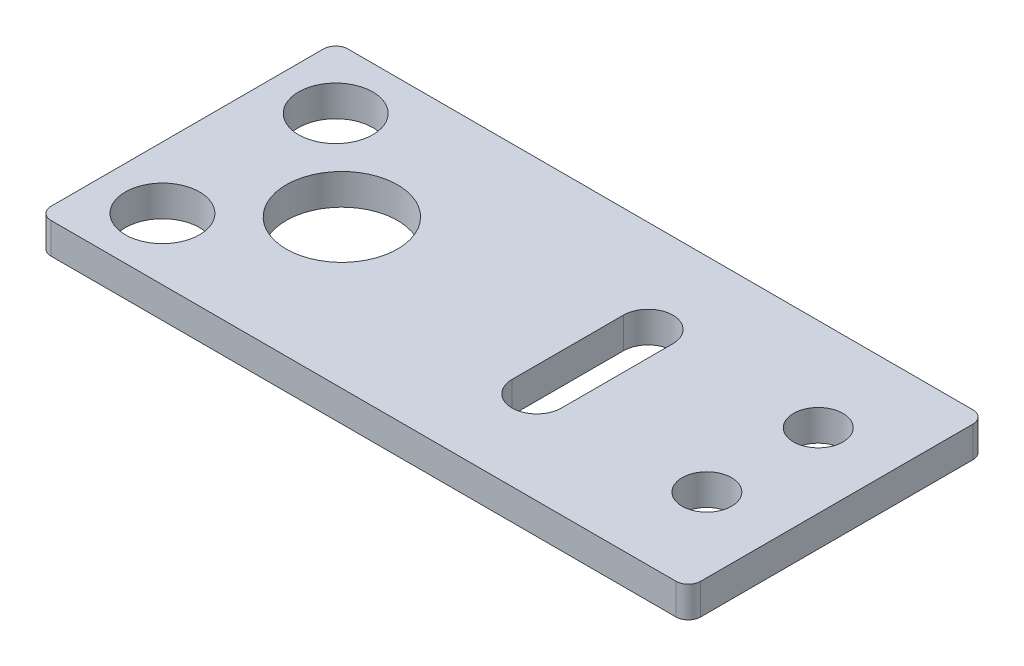
from build123d import *

# Parameters (mm, degrees)
SKETCH1_W           = 105
SKETCH1_H           = 48
SKETCH1_R           = 6
SKETCH1_R_2         = 9
SKETCH1_R_3         = 4
BOSS_EXTRUDE1_DEPTH = 5
FILLET1_R           = 2


with BuildPart() as part:
    # Sketch1 → Boss-Extrude1 (new body)
    with BuildSketch(Plane(origin=(0, 0, 0), x_dir=(1, 0, 0), z_dir=(0, 1, 0))):
        with Locations((52.5, 24)):
            Rectangle(SKETCH1_W, SKETCH1_H)
        with Locations(Location((10, 10, 0), (0, 0, 270))):
            Circle(SKETCH1_R, mode=Mode.SUBTRACT)
        with Locations(Location((10, 38, 0), (0, 0, 270))):
            Circle(SKETCH1_R, mode=Mode.SUBTRACT)
        with Locations(Location((25, 24, 0), (0, 0, 270))):
            Circle(SKETCH1_R_2, mode=Mode.SUBTRACT)
        with Locations(Location((93, 15, 0), (0, 0, 270))):
            Circle(SKETCH1_R_3, mode=Mode.SUBTRACT)
        with Locations(Location((93, 33, 0), (0, 0, 270))):
            Circle(SKETCH1_R_3, mode=Mode.SUBTRACT)
        with BuildLine():
            Line((61.5, 33), (61.5, 15))
            ThreePointArc((61.5, 15), (65.5, 11), (69.5, 15))
            Line((69.5, 15), (69.5, 33))
            ThreePointArc((69.5, 33), (65.5, 37), (61.5, 33))
        make_face(mode=Mode.SUBTRACT)
    extrude(amount=BOSS_EXTRUDE1_DEPTH)

    # Fillet1
    fillet1_edges = [part.edges().sort_by_distance(p)[0] for p in [
        (0, 2.5, -48),
        (105, 2.5, -48),
        (105, 2.5, 0),
        (0, 2.5, 0),
    ]]
    fillet(fillet1_edges, radius=FILLET1_R)


solid = part.part
